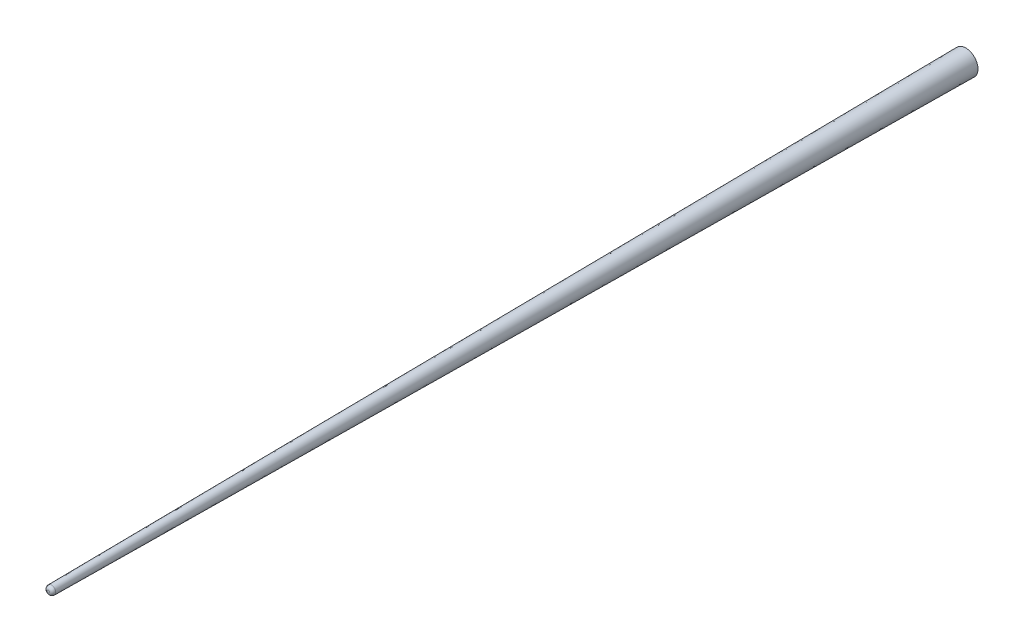
from build123d import *

# Parameters (mm, degrees)
SKETCH1_R           = 0.508
BOSS_EXTRUDE1_DEPTH = 38.1
BOSS_EXTRUDE1_TAPER = 0.5
FILLET2_R           = 0.127


with BuildPart() as part:
    # Sketch1 → Boss-Extrude1 (new body)
    with BuildSketch(Plane.XY):
        Circle(SKETCH1_R)
    extrude(amount=BOSS_EXTRUDE1_DEPTH, taper=BOSS_EXTRUDE1_TAPER)

    # Fillet2
    fillet2_edges = [part.edges().sort_by_distance(p)[0] for p in [
        (-0.175506337, 0, 38.1),
    ]]
    fillet(fillet2_edges, radius=FILLET2_R)


solid = part.part
